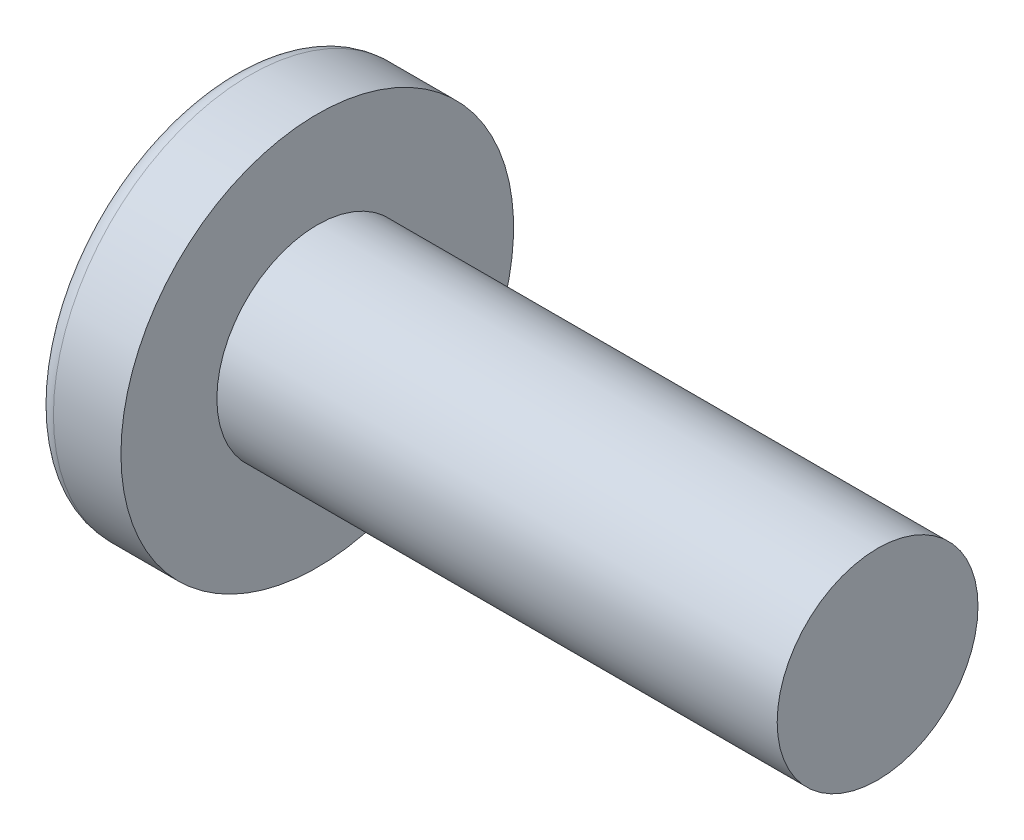
from build123d import *

# Parameters (mm, degrees)
CIRPATTERN1_COUNT = 2
CIRPATTERN1_ANGLE = 90


with BuildPart() as part:
    # BodySke → Base-Revolve (revolve)
    with BuildSketch(Plane.XY, mode=Mode.PRIVATE) as base_revolve_sk:
        with BuildLine():
            Line((2.032, 1.4224), (2.032, 2.7813))
            Line((2.032, 2.7813), (1.075646615, 2.7813))
            ThreePointArc((1.075646615, 2.7813), (0.960371669, 2.753635341), (0.87020729, 2.676667612))
            ThreePointArc((0.87020729, 2.676667612), (0.223015279, 1.407285528), (0, 0))
            Line((0, 0), (9.9695, 0))
            Line((9.9695, 0), (9.9695, 1.4224))
            Line((9.9695, 1.4224), (2.032, 1.4224))
        make_face()
    revolve(base_revolve_sk.sketch.rotate(Axis((-25.4, 0, 0), (1, 0, 0)), 90), axis=Axis((-25.4, 0, 0), (1, 0, 0)))

    # Sketch3 → Cut-Loft1 section 0
    with BuildSketch(Plane(origin=(0, 0, 0), x_dir=(0, 0, -1), z_dir=(1, 0, 0))):
        with BuildLine():
            Line((0.4064, -1.8161), (-0.4064, -1.8161))
            Line((-0.4064, -1.8161), (-0.4064, 1.8161))
            Line((-0.4064, 1.8161), (0.4064, 1.8161))
            Line((0.4064, 1.8161), (0.4064, -1.8161))
        make_face()
    # Sketch4 → Cut-Loft1 section 1
    with BuildSketch(Plane(origin=(2.0066, 0, 0), x_dir=(0, 0, -1), z_dir=(1, 0, 0))):
        with BuildLine():
            Line((0.2032, -0.2032), (-0.2032, -0.2032))
            Line((-0.2032, -0.2032), (-0.2032, 0.2032))
            Line((-0.2032, 0.2032), (0.2032, 0.2032))
            Line((0.2032, 0.2032), (0.2032, -0.2032))
        make_face()
    cut_loft1 = loft(mode=Mode.SUBTRACT)

    # CirPattern1: Cut-Loft1 ×2 about axis
    cirpattern1_axis = Axis((0, 0, 0), (1, 0, 0))
    for i in range(1, CIRPATTERN1_COUNT):
        add(cut_loft1.rotate(cirpattern1_axis, i * CIRPATTERN1_ANGLE / (CIRPATTERN1_COUNT - 1)), mode=Mode.SUBTRACT)


solid = part.part
